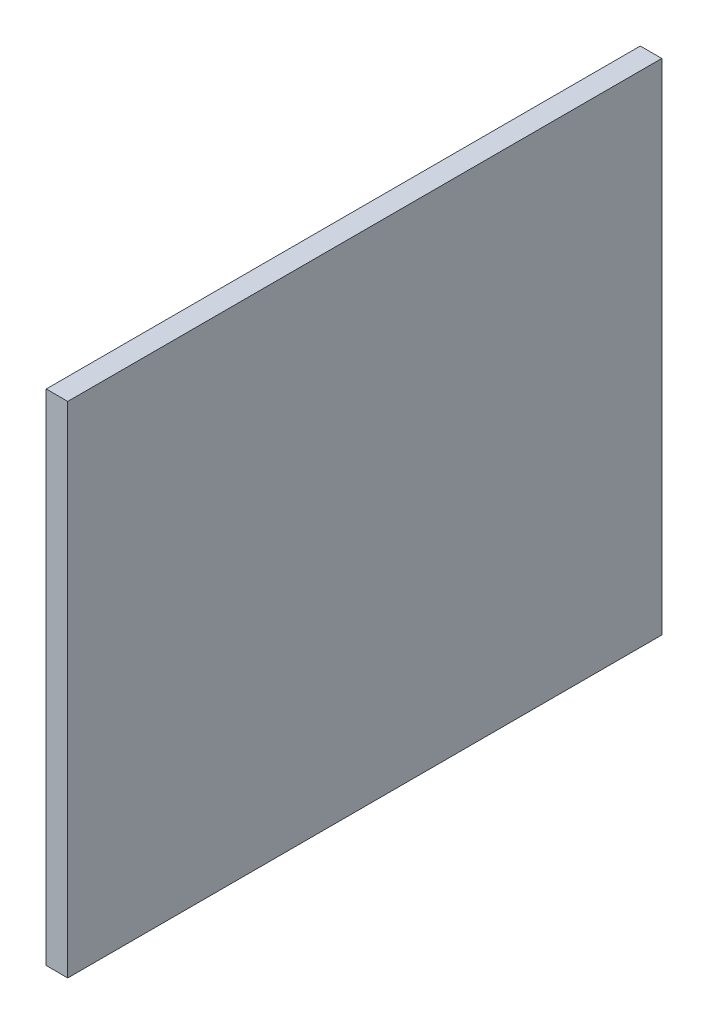
from build123d import *

# Parameters (mm, degrees)
SKETCH2_W           = 13.8
SKETCH2_H           = 11.6
BOSS_EXTRUDE1_DEPTH = 0.5


with BuildPart() as part:
    # Sketch2 → Boss-Extrude1 (new body)
    with BuildSketch(Plane(origin=(0, 0, 0), x_dir=(0, 0, -1), z_dir=(1, 0, 0))):
        with Locations((-0.466423358, 0.889051095)):
            Rectangle(SKETCH2_W, SKETCH2_H)
    extrude(amount=BOSS_EXTRUDE1_DEPTH)


solid = part.part
